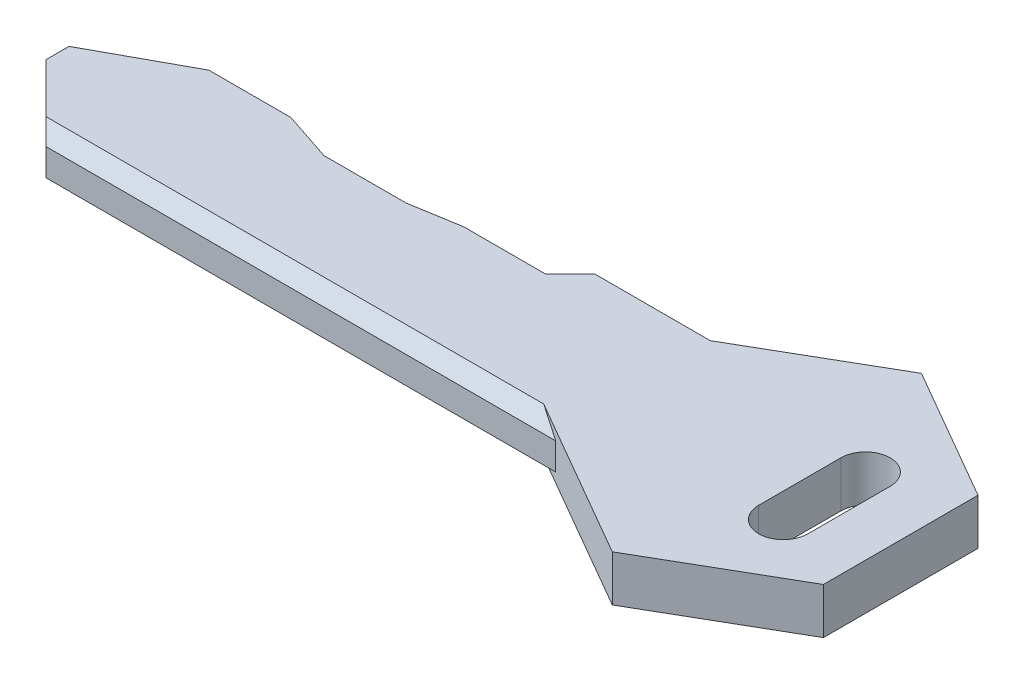
from build123d import *

# Parameters (mm, degrees)
SKETCH1_W           = 35
SKETCH1_H           = 9.4
BOSS_EXTRUDE1_DEPTH = 2.8
SKETCH2_W           = 3.1
SKETCH2_H           = 1.6
CUT_EXTRUDE1_DEPTH  = 35
CHAMFER2_SIZE       = 4
CHAMFER5_SIZE       = 1
CHAMFER5_SIZE2      = 0.577350269
CHAMFER6_SIZE       = 1
CHAMFER6_SIZE2      = 0.577350269
CUT_EXTRUDE2_DEPTH  = 10


with BuildPart() as part:
    # Sketch1 → Boss-Extrude1 (new body)
    # profile 1 of 2: a face of its own
    with BuildSketch(Plane(origin=(0, 0, 0), x_dir=(1, 0, 0), z_dir=(0, 1, 0))):
        with Locations((17.5, 4.7)):
            Rectangle(SKETCH1_W, SKETCH1_H)
    # profile 2 of 2: a face of its own
    with BuildSketch(Plane(origin=(0, 0, 0), x_dir=(1, 0, 0), z_dir=(0, 1, 0))):
        Polygon((35, 0), (35, 9.4), (43.140638796, 14.1), (51.281277591, 9.4), (51.281277591, 0), (43.140638796, -4.7), align=None)
        with BuildLine():
            ThreePointArc((45.140638796, 2.2), (46.640638796, 0.7), (48.140638796, 2.2))
            Line((48.140638796, 2.2), (48.140638796, 7.2))
            ThreePointArc((48.140638796, 7.2), (46.640638796, 8.7), (45.140638796, 7.2))
            Line((45.140638796, 7.2), (45.140638796, 2.2))
        make_face(mode=Mode.SUBTRACT)
    extrude(amount=BOSS_EXTRUDE1_DEPTH)

    # Sketch2 → Cut-Extrude1 (cut)
    with BuildSketch(Plane.ZY):
        with Locations((-4.45, 0.8)):
            Rectangle(SKETCH2_W, SKETCH2_H)
    extrude(amount=-CUT_EXTRUDE1_DEPTH, mode=Mode.SUBTRACT)

    # Chamfer2
    chamfer2_edges = [part.edges().sort_by_distance(p)[0] for p in [
        (0, 1.4, 0),
    ]]
    chamfer(chamfer2_edges, length=CHAMFER2_SIZE)

    # Chamfer5
    chamfer5_edges = [part.edges().sort_by_distance(p)[0] for p in [
        (19.5, 0, 0),
    ]]
    chamfer5_side = [part.faces().sort_by_distance(p)[0] for p in [
        (18.05, 0, -2.353812355),
    ]]
    chamfer(chamfer5_edges, length=CHAMFER5_SIZE, length2=CHAMFER5_SIZE2, reference=chamfer5_side[0])

    # Chamfer6
    chamfer6_edges = [part.edges().sort_by_distance(p)[0] for p in [
        (19.5, 2.8, 0),
    ]]
    chamfer6_side = [part.faces().sort_by_distance(p)[0] for p in [
        (27.665536573, 2.8, -4.750962089),
    ]]
    chamfer(chamfer6_edges, length=CHAMFER6_SIZE, length2=CHAMFER6_SIZE2, reference=chamfer6_side[0])

    # Sketch3 → Cut-Extrude2 (cut)
    with BuildSketch(Plane(origin=(0, 2.8, 0), x_dir=(1, 0, 0), z_dir=(0, 1, 0))):
        Polygon((8, 8.4), (10.5, 8.4), (13.5, 7.4), (16, 7.4), (18.5, 7.4), (21.5, 7.9), (24, 7.9), (26.5, 7.9), (28, 9.4), (4, 9.4), (0, 9.4), (0, 5.4), (5.5, 8.4), align=None)
    extrude(amount=-CUT_EXTRUDE2_DEPTH, mode=Mode.SUBTRACT)


solid = part.part
